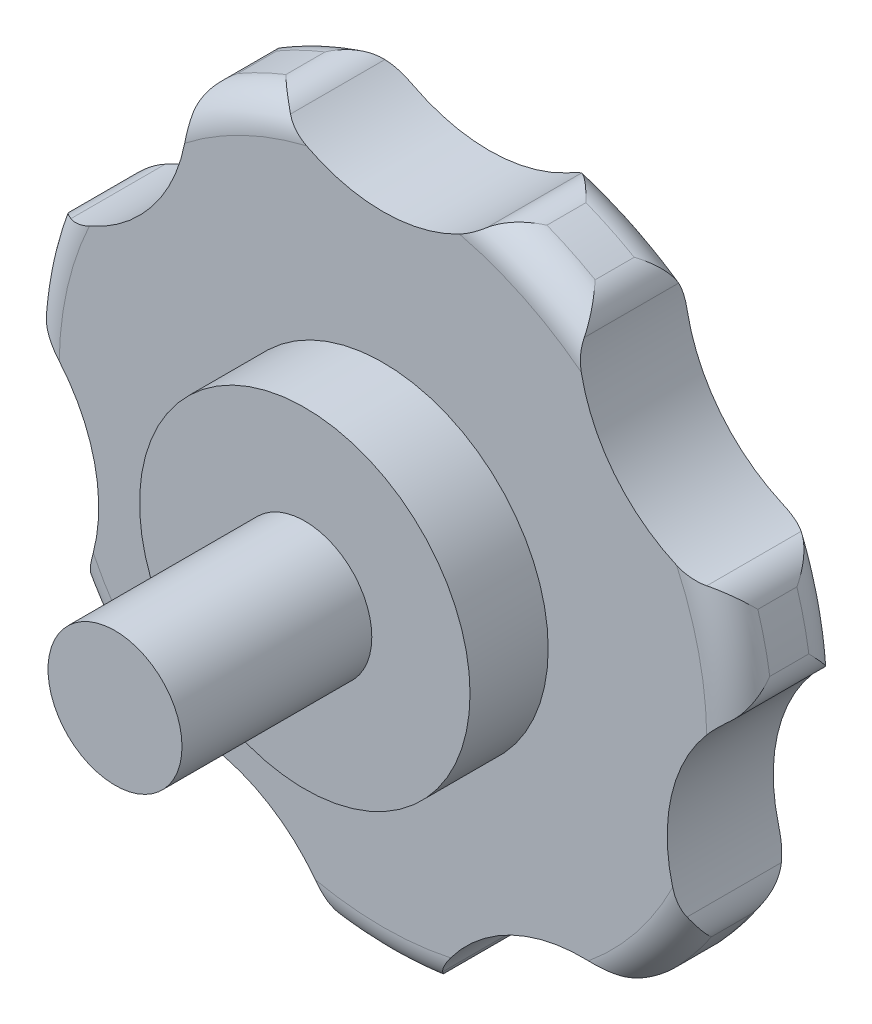
from build123d import *

# Parameters (mm, degrees)
SKETCH1_R           = 16
BOSS_EXTRUDE1_DEPTH = 8.5
SKETCH2_R           = 7.4
BOSS_EXTRUDE2_DEPTH = 3.5
SKETCH3_R           = 3
CUT_EXTRUDE1_DEPTH  = 3.5
SKETCH5_R           = 17.906224745
CUT_EXTRUDE2_DEPTH  = 25.084486708
FILLET1_R           = 1.5
SKETCH6_R           = 3
BOSS_EXTRUDE3_DEPTH = 12


with BuildPart() as part:
    # Sketch1 → Boss-Extrude1 (new body)
    with BuildSketch(Plane.XY):
        Circle(SKETCH1_R)
    extrude(amount=BOSS_EXTRUDE1_DEPTH)

    # Sketch2 → Boss-Extrude2 (add)
    with BuildSketch(Plane.XY.offset(8.5)):
        Circle(SKETCH2_R)
    extrude(amount=BOSS_EXTRUDE2_DEPTH)

    # Sketch3 → Cut-Extrude1 (cut)
    with BuildSketch(Plane.XY.offset(12)):
        Circle(SKETCH3_R)
    extrude(amount=-CUT_EXTRUDE1_DEPTH, mode=Mode.SUBTRACT)

    # Sketch4 → Cut-Revolve1 (revolve, cut)
    with BuildSketch(Plane(origin=(0, 0, 0), x_dir=(1, 0, 0), z_dir=(0, 1, 0))):
        with BuildLine():
            Line((0, 0), (0, 2.922310875))
            Line((0, 2.922310875), (-18.603726576, 2.922310875))
            Line((-18.603726576, 2.922310875), (-18.603726576, -3.75))
            Line((-18.603726576, -3.75), (-8.5, -3.75))
            ThreePointArc((-8.5, -3.75), (-4.645226044, -0.9791543), (0, 0))
        make_face()
    revolve(axis=Axis((0, 0, 0), (0, 0, -1)), mode=Mode.SUBTRACT)

    # Sketch5 → Cut-Extrude2 (cut, through all)
    with BuildSketch(Plane(origin=(0, 0, 3.75), x_dir=(-1, 0, 0), z_dir=(0, 0, -1))):
        Circle(SKETCH5_R)
        with BuildLine():
            ThreePointArc((-5, 15.198684154), (0, 13.246445087), (5, 15.198684154))
            ThreePointArc((5, 15.198684154), (6.942139826, 14.415501886), (8.765360754, 13.385381984))
            ThreePointArc((8.765360754, 13.385381984), (10.3564878, 8.259023423), (15.000258773, 5.567067159))
            ThreePointArc((15.000258773, 5.567067159), (15.598846595, 3.560334943), (15.93022608, 1.492614168))
            ThreePointArc((15.93022608, 1.492614168), (12.914329053, -2.947611332), (13.70501674, -8.256664954))
            ThreePointArc((13.70501674, -8.256664954), (12.509303719, -9.97583683), (11.09930625, -11.52412256))
            ThreePointArc((11.09930625, -11.52412256), (5.747417125, -11.934634634), (2.089617571, -15.862959951))
            ThreePointArc((2.089617571, -15.862959951), (0, -16), (-2.089617571, -15.862959951))
            ThreePointArc((-2.089617571, -15.862959951), (-5.747417125, -11.934634634), (-11.09930625, -11.52412256))
            ThreePointArc((-11.09930625, -11.52412256), (-12.509303719, -9.97583683), (-13.70501674, -8.256664954))
            ThreePointArc((-13.70501674, -8.256664954), (-12.914329053, -2.947611332), (-15.93022608, 1.492614168))
            ThreePointArc((-15.93022608, 1.492614168), (-15.598846595, 3.560334943), (-15.000258773, 5.567067159))
            ThreePointArc((-15.000258773, 5.567067159), (-10.3564878, 8.259023423), (-8.765360754, 13.385381984))
            ThreePointArc((-8.765360754, 13.385381984), (-6.942139826, 14.415501886), (-5, 15.198684154))
        make_face(mode=Mode.SUBTRACT)
    extrude(amount=-CUT_EXTRUDE2_DEPTH, mode=Mode.SUBTRACT)

    # Fillet1
    fillet1_edges = [part.edges().sort_by_distance(p)[0] for p in [
        (-15.598846595, 3.560334943, 3.75),
        (-6.942139826, 14.415501886, 3.75),
        (6.942139826, 14.415501886, 3.75),
        (15.598846595, 3.560334943, 3.75),
        (12.509303719, -9.97583683, 3.75),
        (0, -16, 3.75),
        (-12.509303719, -9.97583683, 3.75),
        (6.942139826, 14.415501886, 8.5),
        (-6.942139826, 14.415501886, 8.5),
        (-15.598846595, 3.560334943, 8.5),
        (-12.509303719, -9.97583683, 8.5),
        (0, -16, 8.5),
        (12.509303719, -9.97583683, 8.5),
        (15.598846595, 3.560334943, 8.5),
        (5, 15.198684154, 6.125),
        (-5, 15.198684154, 6.125),
        (-8.765360754, 13.385381984, 6.125),
        (-15.000258773, 5.567067159, 6.125),
        (-15.93022608, 1.492614168, 6.125),
        (-13.70501674, -8.256664954, 6.125),
        (-11.09930625, -11.52412256, 6.125),
        (-2.089617571, -15.862959951, 6.125),
        (2.089617571, -15.862959951, 6.125),
        (11.09930625, -11.52412256, 6.125),
        (13.70501674, -8.256664954, 6.125),
        (15.93022608, 1.492614168, 6.125),
        (15.000258773, 5.567067159, 6.125),
        (8.765360754, 13.385381984, 6.125),
    ]]
    fillet(fillet1_edges, radius=FILLET1_R)


with BuildPart() as body_2:
    # Sketch6 → Boss-Extrude3 (new body)
    with BuildSketch(Plane.XY.offset(8.5)):
        Circle(SKETCH6_R)
    extrude(amount=BOSS_EXTRUDE3_DEPTH)


solid = Compound([part.part, body_2.part])
